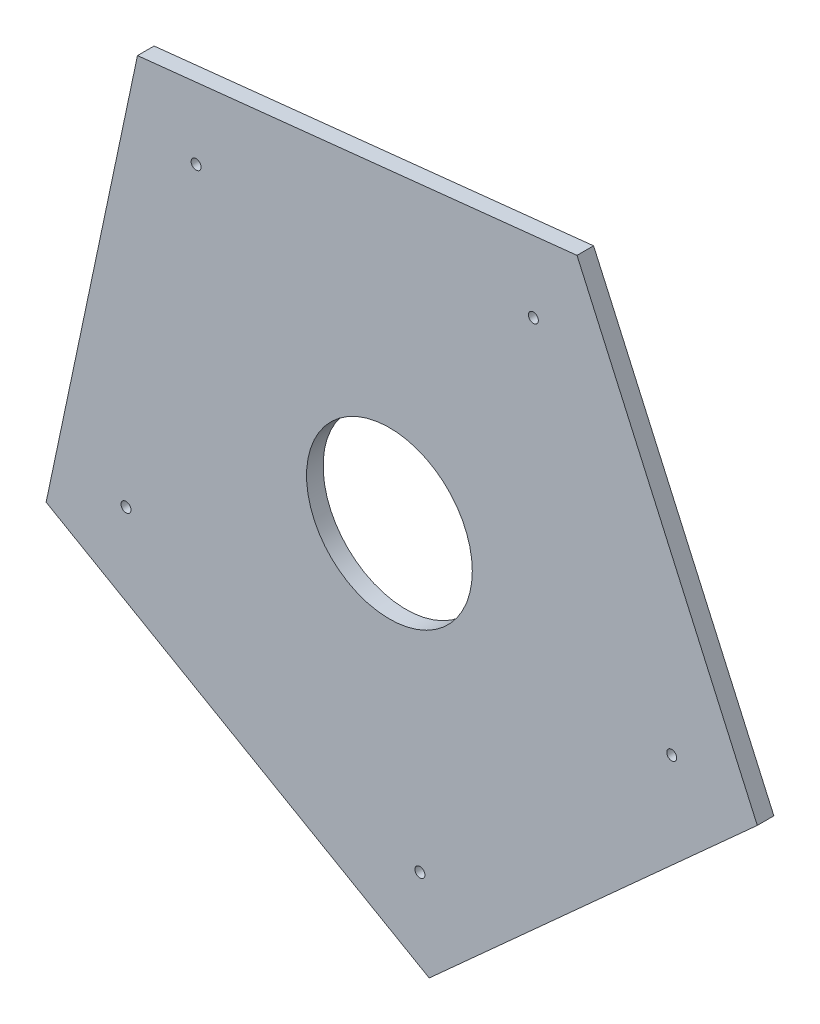
from build123d import *

# Parameters (mm, degrees)
BOSS_EXTRUDE1_DEPTH = 3
SKETCH3_R           = 15
CUT_EXTRUDE1_DEPTH  = 3
SKETCH4_R           = 0.9
CUT_EXTRUDE2_DEPTH  = 3
CIRPATTERN1_COUNT   = 5


with BuildPart() as part:
    # Sketch1 → Boss-Extrude1 (new body)
    with BuildSketch(Plane.XY):
        Polygon((-62.133450379, -27.758203286), (7.199328029, -67.670179411), (66.582879797, -14.064267615), (33.951154754, 58.977983998), (-45.599912202, 50.514666314), align=None)
    extrude(amount=BOSS_EXTRUDE1_DEPTH)

    # Sketch3 → Cut-Extrude1 (cut)
    with BuildSketch(Plane.XY.offset(3)):
        Circle(SKETCH3_R)
    extrude(amount=-CUT_EXTRUDE1_DEPTH, mode=Mode.SUBTRACT)

    # Sketch4 → Cut-Extrude2 (cut)
    with BuildSketch(Plane(origin=(0, 0, 0), x_dir=(-1, 0, 0), z_dir=(0, 0, -1))):
        with Locations((47.678329741, -21.300358522)):
            Circle(SKETCH4_R)
    cut_extrude2 = extrude(amount=-CUT_EXTRUDE2_DEPTH, mode=Mode.SUBTRACT)

    # CirPattern1: Cut-Extrude2 ×5 about axis
    cirpattern1_axis = Axis((0, 0, 0), (0, 0, 1))
    for i in range(1, CIRPATTERN1_COUNT):
        add(cut_extrude2.rotate(cirpattern1_axis, i * 360 / CIRPATTERN1_COUNT), mode=Mode.SUBTRACT)


solid = part.part
